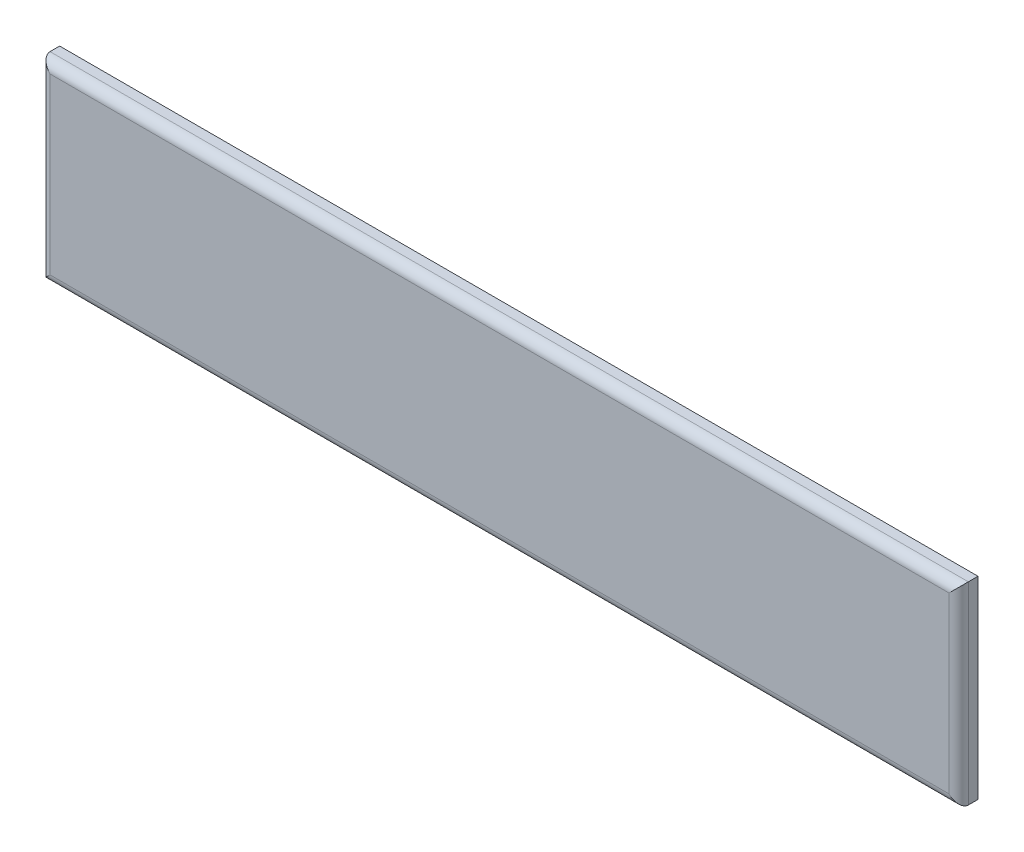
from build123d import *

# Parameters (mm, degrees)
SKETCH1_W                      = 95
SKETCH1_H                      = 20
BOSS_EXTRUDE1_DEPTH            = 1
FILLET1_R                      = 1
F_1_0MM_DOWEL_HOLE1_AT_2_COUNT = 2
F_1_0MM_DOWEL_HOLE1_AT_2_PITCH = 4
F_1_0MM_DOWEL_HOLE1_AT_3_COUNT = 2
F_1_0MM_DOWEL_HOLE1_AT_3_PITCH = 84
F_1_0MM_DOWEL_HOLE1_AT_4_COUNT = 2
F_1_0MM_DOWEL_HOLE1_AT_4_PITCH = 88
F_1_0MM_DOWEL_HOLE2_AT_2_COUNT = 2
F_1_0MM_DOWEL_HOLE2_AT_2_PITCH = 3.4


with BuildPart() as part:
    # Sketch1 → Boss-Extrude1 (new, symmetric)
    with BuildSketch(Plane.XY):
        Rectangle(SKETCH1_W, SKETCH1_H)
    extrude(amount=BOSS_EXTRUDE1_DEPTH, both=True)

    # Fillet1
    fillet1_edges = [part.edges().sort_by_distance(p)[0] for p in [
        (47.5, 0, 1),
        (0, 10, 1),
        (-47.5, 0, 1),
        (0, -10, 1),
    ]]
    fillet(fillet1_edges, radius=FILLET1_R)

    # Sketch3 → Ø1.0mm Dowel Hole1 (revolve, cut)
    with BuildSketch(Plane(origin=(44, -8, -1), x_dir=(0, 1, 0), z_dir=(1, 0, 0))):
        Polygon((0, 0), (0, 1.150215155), (0.25, 1), (0.25, 0), align=None)
    f_1_0mm_dowel_hole1 = revolve(axis=Axis((44, -8, -7.35), (0, 0, 1)), mode=Mode.SUBTRACT)

    # Ø1.0mm Dowel Hole1 at 2: Ø1.0mm Dowel Hole1 ×2
    with Locations(*[(-i * F_1_0MM_DOWEL_HOLE1_AT_2_PITCH, 0, 0) for i in range(1, F_1_0MM_DOWEL_HOLE1_AT_2_COUNT)]):
        add(f_1_0mm_dowel_hole1, mode=Mode.SUBTRACT)

    # Ø1.0mm Dowel Hole1 at 3: Ø1.0mm Dowel Hole1 ×2
    with Locations(*[(-i * F_1_0MM_DOWEL_HOLE1_AT_3_PITCH, 0, 0) for i in range(1, F_1_0MM_DOWEL_HOLE1_AT_3_COUNT)]):
        add(f_1_0mm_dowel_hole1, mode=Mode.SUBTRACT)

    # Ø1.0mm Dowel Hole1 at 4: Ø1.0mm Dowel Hole1 ×2
    with Locations(*[(-i * F_1_0MM_DOWEL_HOLE1_AT_4_PITCH, 0, 0) for i in range(1, F_1_0MM_DOWEL_HOLE1_AT_4_COUNT)]):
        add(f_1_0mm_dowel_hole1, mode=Mode.SUBTRACT)

    # Mirror1: Ø1.0mm Dowel Hole1 across plane
    add(f_1_0mm_dowel_hole1.mirror(Plane.ZX), mode=Mode.SUBTRACT)

    # Mirror1 copy 1 sketch → Mirror1 copy 1 (revolve, cut)
    with BuildSketch(Plane(origin=(40, 8, -1), x_dir=(0, -1, 0), z_dir=(1, 0, 0))):
        Polygon((0, 0), (0, -1.150215155), (0.25, -1), (0.25, 0), align=None)
    revolve(axis=Axis((40, 8, -7.35), (0, 0, -1)), mode=Mode.SUBTRACT)

    # Mirror1 copy 2 sketch → Mirror1 copy 2 (revolve, cut)
    with BuildSketch(Plane(origin=(-40, 8, -1), x_dir=(0, -1, 0), z_dir=(1, 0, 0))):
        Polygon((0, 0), (0, -1.150215155), (0.25, -1), (0.25, 0), align=None)
    revolve(axis=Axis((-40, 8, -7.35), (0, 0, -1)), mode=Mode.SUBTRACT)

    # Mirror1 copy 3 sketch → Mirror1 copy 3 (revolve, cut)
    with BuildSketch(Plane(origin=(-44, 8, -1), x_dir=(0, -1, 0), z_dir=(1, 0, 0))):
        Polygon((0, 0), (0, -1.150215155), (0.25, -1), (0.25, 0), align=None)
    revolve(axis=Axis((-44, 8, -7.35), (0, 0, -1)), mode=Mode.SUBTRACT)

    # Sketch5 → Ø1.0mm Dowel Hole2 (revolve, cut)
    with BuildSketch(Plane(origin=(46.8, 0, -1), x_dir=(0, 1, 0), z_dir=(1, 0, 0))):
        Polygon((0, 0), (0, 1.150215155), (0.25, 1), (0.25, 0), align=None)
    f_1_0mm_dowel_hole2 = revolve(axis=Axis((46.8, 0, -7.35), (0, 0, 1)), mode=Mode.SUBTRACT)

    # Ø1.0mm Dowel Hole2 at 2: Ø1.0mm Dowel Hole2 ×2
    with Locations(*[(-i * F_1_0MM_DOWEL_HOLE2_AT_2_PITCH, 0, 0) for i in range(1, F_1_0MM_DOWEL_HOLE2_AT_2_COUNT)]):
        add(f_1_0mm_dowel_hole2, mode=Mode.SUBTRACT)

    # Mirror2: Ø1.0mm Dowel Hole2 across plane
    add(f_1_0mm_dowel_hole2.mirror(Plane(origin=(0, 0, 0), x_dir=(0, 0, 1), z_dir=(1, 0, 0))), mode=Mode.SUBTRACT)

    # Mirror2 copy 1 sketch → Mirror2 copy 1 (revolve, cut)
    with BuildSketch(Plane(origin=(-43.4, 0, -1), x_dir=(0, 1, 0), z_dir=(-1, 0, 0))):
        Polygon((0, 0), (0, -1.150215155), (0.25, -1), (0.25, 0), align=None)
    revolve(axis=Axis((-43.4, 0, -7.35), (0, 0, -1)), mode=Mode.SUBTRACT)


solid = part.part
